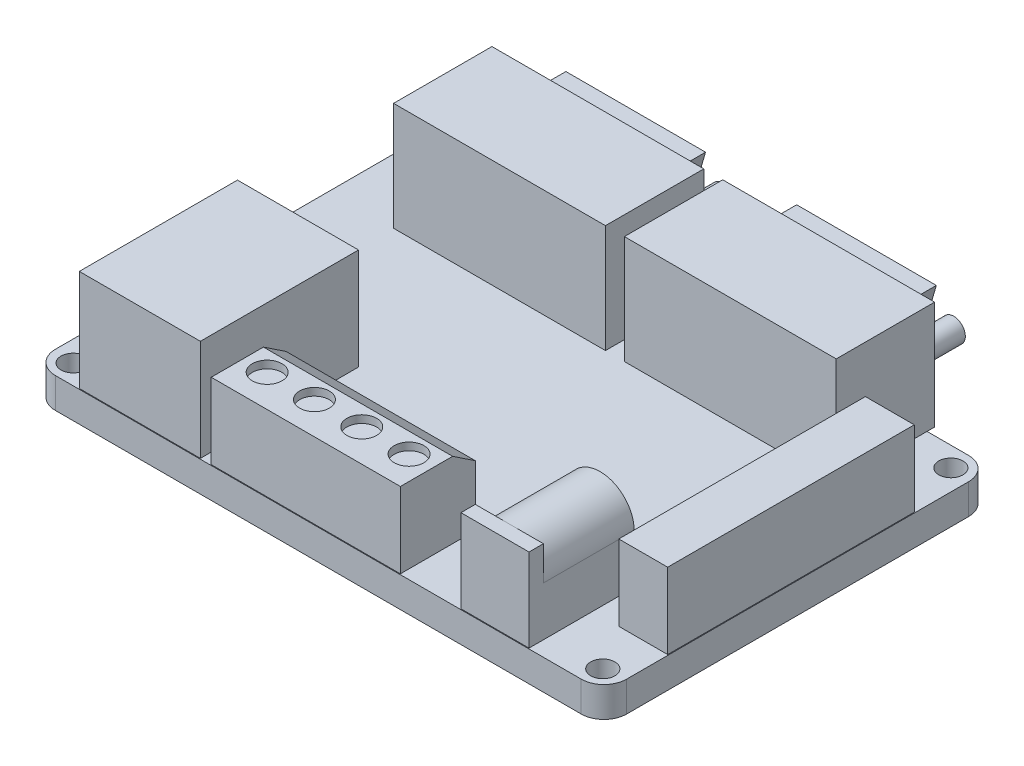
from build123d import *

# Parameters (mm, degrees)
SKETCH_1_W          = 75.5
SKETCH_1_H          = 51.2
EXTRUDE_1_DEPTH     = 4
HOLE_WIZARD_M3_1_D  = 3.2
FILLET_1_R          = 3
SKETCH_4_W          = 9
SKETCH_4_H          = 11
EXTRUDE_2_DEPTH     = 14
CUT_EXTRUDE_1_DEPTH = 12
SKETCH_6_W          = 25
SKETCH_6_H          = 10
EXTRUDE_3_DEPTH     = 10
SKETCH_7_R          = 1.963016799
CUT_EXTRUDE_2_DEPTH = 1
CHAMFER_1_SIZE      = 2
CHAMFER_1_SIZE2     = 3
SKETCH_8_W          = 6.560594773
SKETCH_8_H          = 32.588402295
EXTRUDE_4_DEPTH     = 10
SKETCH_9_W          = 28
SKETCH_9_H          = 18
EXTRUDE_5_DEPTH     = 14.3
SKETCH_10_W         = 28
SKETCH_10_H         = 14.3
SKETCH_10_R         = 1.542197262
CUT_EXTRUDE_3_DEPTH = 5
SKETCH_11_W         = 16
SKETCH_11_H         = 21
EXTRUDE_6_DEPTH     = 13.4
SKETCH_12_W         = 59.433168898
SKETCH_12_H         = 13.4
CUT_EXTRUDE_4_DEPTH = 0.1
SKETCH_13_W         = 32.588402295
SKETCH_13_H         = 10
CUT_EXTRUDE_5_DEPTH = 0.1


with BuildPart() as part:
    # 草图1 → 凸台-拉伸1 (new body)
    with BuildSketch(Plane(origin=(0, 0, 0), x_dir=(1, 0, 0), z_dir=(0, 1, 0))):
        Rectangle(SKETCH_1_W, SKETCH_1_H)
    extrude(amount=EXTRUDE_1_DEPTH)

    # M3 间隙孔1 (through all)
    with Locations(Plane(origin=(0, 4, 0), x_dir=(1, 0, 0), z_dir=(0, 1, 0))):
        with Locations((-35, 23), (35, 23), (-35, -23), (35, -23)):
            Hole(HOLE_WIZARD_M3_1_D / 2)

    # 圆角1
    fillet_1_edges = [part.edges().sort_by_distance(p)[0] for p in [
        (-37.75, 2, -25.6),
        (37.75, 2, -25.6),
        (37.75, 2, 25.6),
        (-37.75, 2, 25.6),
    ]]
    fillet(fillet_1_edges, radius=FILLET_1_R)

    # 草图4 → 凸台-拉伸2 (add)
    with BuildSketch(Plane.XY.offset(25.6)):
        with Locations((23.25, 9.5)):
            Rectangle(SKETCH_4_W, SKETCH_4_H)
    extrude(amount=-EXTRUDE_2_DEPTH)

    # 草图5 → 切除-拉伸1 (cut)
    with BuildSketch(Plane(origin=(0, 0, 11.6), x_dir=(-1, 0, 0), z_dir=(0, 0, -1))):
        with BuildLine():
            Line((-27.75, 10.5), (-28.75, 10.5))
            Line((-28.75, 10.5), (-28.75, 16))
            Line((-28.75, 16), (-17.75, 16))
            Line((-17.75, 16), (-17.75, 10.5))
            Line((-17.75, 10.5), (-18.75, 10.5))
            ThreePointArc((-18.75, 10.5), (-23.25, 15), (-27.75, 10.5))
        make_face()
    extrude(amount=-CUT_EXTRUDE_1_DEPTH, mode=Mode.SUBTRACT)

    # 草图6 → 凸台-拉伸3 (add)
    with BuildSketch(Plane(origin=(0, 4, 0), x_dir=(1, 0, 0), z_dir=(0, 1, 0))):
        with Locations((-1.75, -20.6)):
            Rectangle(SKETCH_6_W, SKETCH_6_H)
    extrude(amount=EXTRUDE_3_DEPTH)

    # 草图7 → 切除-拉伸2 (cut)
    with BuildSketch(Plane(origin=(0, 14, 0), x_dir=(1, 0, 0), z_dir=(0, 1, 0))):
        with Locations(Location((-11.125, -21.230534839, 0), (0, 0, 270))):
            Circle(SKETCH_7_R)
        with Locations(Location((-4.875, -21.230534839, 0), (0, 0, 90))):
            Circle(SKETCH_7_R)
        with Locations(Location((7.625, -21.230534839, 0), (0, 0, 90))):
            Circle(SKETCH_7_R)
        with Locations(Location((1.375, -21.230534839, 0), (0, 0, 270))):
            Circle(SKETCH_7_R)
    extrude(amount=-CUT_EXTRUDE_2_DEPTH, mode=Mode.SUBTRACT)

    # 倒角1
    chamfer_1_edges = [part.edges().sort_by_distance(p)[0] for p in [
        (-1.75, 14, 15.6),
    ]]
    chamfer_1_side = [part.faces().sort_by_distance(p)[0] for p in [
        (-1.75, 9, 15.6),
    ]]
    chamfer(chamfer_1_edges, length=CHAMFER_1_SIZE, length2=CHAMFER_1_SIZE2, reference=chamfer_1_side[0])

    # 草图8 → 凸台-拉伸4 (add)
    with BuildSketch(Plane(origin=(0, 4, 0), x_dir=(1, 0, 0), z_dir=(0, 1, 0))):
        with Locations((34.469702614, -0.78179248)):
            Rectangle(SKETCH_8_W, SKETCH_8_H)
    extrude(amount=EXTRUDE_4_DEPTH)

    # 草图9 → 凸台-拉伸5 (add)
    with BuildSketch(Plane(origin=(0, 4, 0), x_dir=(1, 0, 0), z_dir=(0, 1, 0))):
        with Locations((-15.25, 22.6)):
            Rectangle(SKETCH_9_W, SKETCH_9_H)
        with Locations((15.25, 22.6)):
            Rectangle(SKETCH_9_W, SKETCH_9_H)
    extrude(amount=EXTRUDE_5_DEPTH)

    # 草图10 → 切除-拉伸3 (cut)
    # profile 1 of 2: a face of its own
    with BuildSketch(Plane(origin=(0, 0, -31.6), x_dir=(-1, 0, 0), z_dir=(0, 0, -1))):
        with Locations((-15.25, 11.15)):
            Rectangle(SKETCH_10_W, SKETCH_10_H)
        with Locations((-26.769914648, 11.409080509)):
            Circle(SKETCH_10_R, mode=Mode.SUBTRACT)
        with Locations((-3.730085352, 11.409080509)):
            Circle(SKETCH_10_R, mode=Mode.SUBTRACT)
        Polygon((-22.404607637, 8.177619476), (-8.095392363, 8.177619476), (-6.020301502, 15.325154661), (-24.479698498, 15.325154661), align=None, mode=Mode.SUBTRACT)
    # profile 2 of 2: a face of its own
    with BuildSketch(Plane(origin=(0, 0, -31.6), x_dir=(-1, 0, 0), z_dir=(0, 0, -1))):
        with Locations((15.25, 11.15)):
            Rectangle(SKETCH_10_W, SKETCH_10_H)
        with Locations((3.730085352, 11.409080509)):
            Circle(SKETCH_10_R, mode=Mode.SUBTRACT)
        with Locations((26.769914648, 11.409080509)):
            Circle(SKETCH_10_R, mode=Mode.SUBTRACT)
        Polygon((6.020301502, 15.325154661), (8.095392363, 8.177619476), (22.404607637, 8.177619476), (24.479698498, 15.325154661), align=None, mode=Mode.SUBTRACT)
    extrude(amount=-CUT_EXTRUDE_3_DEPTH, mode=Mode.SUBTRACT)

    # 草图11 → 凸台-拉伸6 (add)
    with BuildSketch(Plane(origin=(0, 4, 0), x_dir=(1, 0, 0), z_dir=(0, 1, 0))):
        with Locations((-23.683168898, -15.1)):
            Rectangle(SKETCH_11_W, SKETCH_11_H)
    extrude(amount=EXTRUDE_6_DEPTH)

    # 草图12 → 切除-拉伸4 (cut)
    with BuildSketch(Plane.XY.offset(25.6)):
        with Locations((-1.966584449, 10.7)):
            Rectangle(SKETCH_12_W, SKETCH_12_H)
    extrude(amount=-CUT_EXTRUDE_4_DEPTH, mode=Mode.SUBTRACT)

    # 草图13 → 切除-拉伸5 (cut)
    with BuildSketch(Plane(origin=(37.75, 0, 0), x_dir=(0, 0, -1), z_dir=(1, 0, 0))):
        with Locations((-0.78179248, 9)):
            Rectangle(SKETCH_13_W, SKETCH_13_H)
    extrude(amount=-CUT_EXTRUDE_5_DEPTH, mode=Mode.SUBTRACT)


solid = part.part
